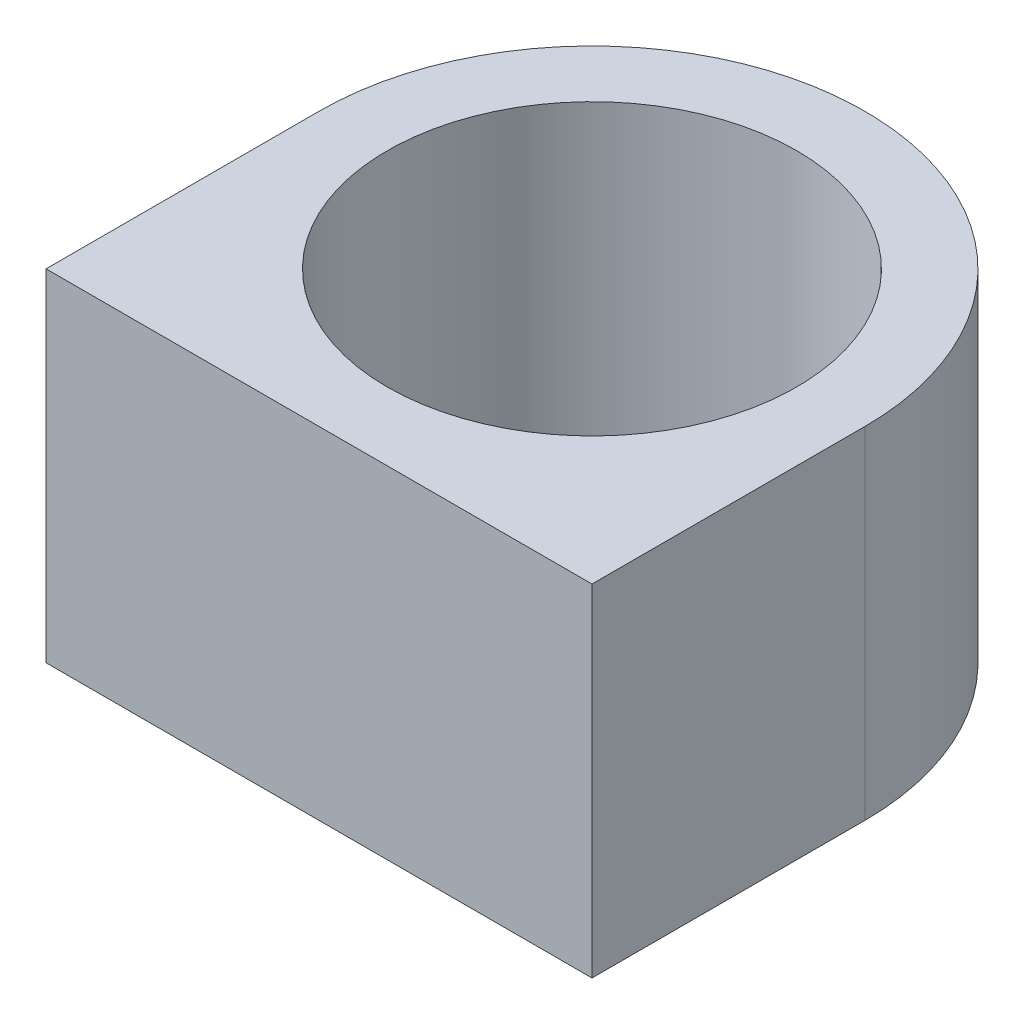
from build123d import *

# Parameters (mm, degrees)
SKETCH1_R           = 3
BOSS_EXTRUDE1_DEPTH = 5


with BuildPart() as part:
    # Sketch1 → Boss-Extrude1 (new body)
    with BuildSketch(Plane(origin=(0, 0, 0), x_dir=(1, 0, 0), z_dir=(0, 1, 0))):
        with BuildLine():
            Line((4, 0), (4, -4))
            Line((4, -4), (-4, -4))
            Line((-4, -4), (-4, 0))
            ThreePointArc((-4, 0), (0, 4), (4, 0))
        make_face()
        with Locations(Location((0, 0, 0), (0, 0, 270))):
            Circle(SKETCH1_R, mode=Mode.SUBTRACT)
    extrude(amount=BOSS_EXTRUDE1_DEPTH)


solid = part.part
